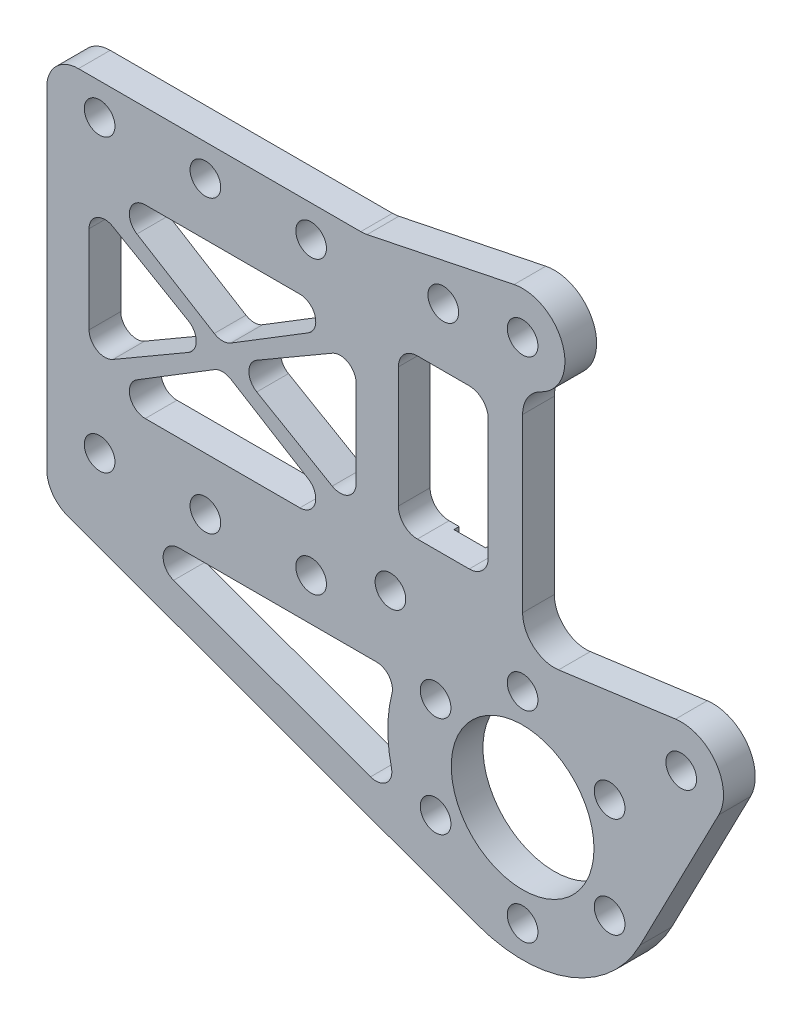
from build123d import *

# Parameters (mm, degrees)
SKETCH_2_R          = 6.75
SKETCH_2_R_2        = 1.45
EXTRUDE_1_DEPTH     = 3
EXTRUDE_START       = -3
SKETCH_4_R          = 1.45
EXTRUDE_2_DEPTH     = 3
SKETCH_5_R          = 1.45
SKETCH_5_W          = 8.5
SKETCH_5_H          = 15
EXTRUDE_3_DEPTH     = 3
SKETCH_7_R          = 1.45
CUT_EXTRUDE_3_DEPTH = 20
FILLET_1_R          = 1.8
FILLET_2_R          = 3
SKETCH_9_R          = 1.45
CUT_EXTRUDE_5_DEPTH = 10.5
FILLET_3_R          = 1.5
SKETCH_10_W         = 3
SKETCH_10_H         = 20
CUT_EXTRUDE_6_DEPTH = 0.5
SKETCH_11_R         = 0.9
CUT_EXTRUDE_7_DEPTH = 0.5


with BuildPart() as part:
    # 草图2 → 凸台-拉伸1 (new body)
    with BuildSketch(Plane.XY):
        with BuildLine():
            Line((-10, -7), (-10, -16.423561614))
            Line((-10, -16.423561614), (30.724748208, -31.24615776))
            ThreePointArc((30.724748208, -31.24615776), (47.310096913, -21.670602221), (35, -7))
            Line((35, -7), (-10, -7))
        make_face()
        with Locations((35, -19.5)):
            Circle(SKETCH_2_R, mode=Mode.SUBTRACT)
        with Locations((15, -10.5)):
            Circle(SKETCH_2_R_2, mode=Mode.SUBTRACT)
        with Locations((5, -10.5)):
            Circle(SKETCH_2_R_2, mode=Mode.SUBTRACT)
        with Locations((-5, -10.5)):
            Circle(SKETCH_2_R_2, mode=Mode.SUBTRACT)
    extrude(amount=EXTRUDE_1_DEPTH)

    # 草图4 → 凸台-拉伸2 (add)
    with BuildSketch(Plane.XY.offset(3).offset(EXTRUDE_START)):
        with BuildLine():
            Line((35, -7), (49.461817276, -5.036370432))
            ThreePointArc((49.461817276, -5.036370432), (53.268884157, -6.694702543), (53.552947171, -10.837543578))
            Line((53.552947171, -10.837543578), (46.102959909, -25.24232368))
            ThreePointArc((46.102959909, -25.24232368), (45.677758332, -13.00111725), (35, -7))
        make_face()
        with Locations((50, -9)):
            Circle(SKETCH_4_R, mode=Mode.SUBTRACT)
    extrude(amount=EXTRUDE_2_DEPTH)

    # 草图5 → 凸台-拉伸3 (add)
    with BuildSketch(Plane(origin=(0, 0, 0), x_dir=(-1, 0, 0), z_dir=(0, 0, -1))):
        with BuildLine():
            Line((-35, -7), (-35, 15))
            ThreePointArc((-35, 15), (-38.979463437, 19.404809528), (-34.194537642, 22.918064623))
            Line((-34.194537642, 22.918064623), (-20, 20))
            Line((-20, 20), (10, 20))
            Line((10, 20), (10, -7))
            Line((10, -7), (-35, -7))
        make_face()
        with Locations((-35, 19)):
            Circle(SKETCH_5_R, mode=Mode.SUBTRACT)
        with Locations((-27.5, 5)):
            Rectangle(SKETCH_5_W, SKETCH_5_H, mode=Mode.SUBTRACT)
    extrude(amount=-EXTRUDE_3_DEPTH)

    # 草图7 → 切除-拉伸3 (cut)
    with BuildSketch(Plane.XY.offset(3)):
        with Locations((27.5, 18)):
            Circle(SKETCH_7_R)
        with Locations((-5, 17)):
            Circle(SKETCH_7_R)
        with Locations((5, 17)):
            Circle(SKETCH_7_R)
        with Locations((15, 17)):
            Circle(SKETCH_7_R)
        with Locations((22.5, -8)):
            Circle(SKETCH_7_R)
    extrude(amount=-CUT_EXTRUDE_3_DEPTH, mode=Mode.SUBTRACT)

    # 圆角1
    fillet_1_edges = [part.edges().sort_by_distance(p)[0] for p in [
        (31.75, 12.5, 1.5),
        (23.25, 12.5, 1.5),
        (23.25, -2.5, 1.5),
        (31.75, -2.5, 1.5),
    ]]
    fillet(fillet_1_edges, radius=FILLET_1_R)

    # 圆角2
    fillet_2_edges = [part.edges().sort_by_distance(p)[0] for p in [
        (35, 15, 1.5),
        (20, 20, 1.5),
        (-10, 20, 1.5),
        (35, -7, 1.5),
        (-10, -16.423561614, 1.5),
    ]]
    fillet(fillet_2_edges, radius=FILLET_2_R)

    # 草图9 → 切除-拉伸5 (cut)
    with BuildSketch(Plane(origin=(0, 0, 0), x_dir=(-1, 0, 0), z_dir=(0, 0, -1))):
        with Locations((-26.772758664, -14.75)):
            Circle(SKETCH_9_R)
        with Locations((-26.772758664, -24.25)):
            Circle(SKETCH_9_R)
        with Locations((-35, -29)):
            Circle(SKETCH_9_R)
        with Locations((-43.227241336, -24.25)):
            Circle(SKETCH_9_R)
        with Locations((-43.227241336, -14.75)):
            Circle(SKETCH_9_R)
        with Locations((-35, -10)):
            Circle(SKETCH_9_R)
        Polygon((-6.625, 4.25), (-19.25, 12), (6, 12), align=None)
        Polygon((-7.625, 3.25), (-19.25, 10), (-19.25, -3.5), align=None)
        Polygon((6, 10), (6, -3.5), (-5.625, 3.25), align=None)
        Polygon((-19.25, -5.5), (6, -5.5), (-6.625, 2.25), align=None)
        with BuildLine():
            Line((-23.271295894, -14.5), (6, -14.5))
            Line((6, -14.5), (-23.639402612, -25.287860312))
            ThreePointArc((-23.639402612, -25.287860312), (-22.257416141, -19.934806402), (-23.271295894, -14.5))
        make_face()
    extrude(amount=-CUT_EXTRUDE_5_DEPTH, mode=Mode.SUBTRACT)

    # 圆角3
    fillet_3_edges = [part.edges().sort_by_distance(p)[0] for p in [
        (5.625, 3.25, 1.5),
        (-6, 10, 1.5),
        (-6, -3.5, 1.5),
        (19.25, -5.5, 1.5),
        (6.625, 2.25, 1.5),
        (-6, -5.5, 1.5),
        (23.639402612, -25.287860312, 1.5),
        (23.271295894, -14.5, 1.5),
        (-6, -14.5, 1.5),
        (7.625, 3.25, 1.5),
        (19.25, -3.5, 1.5),
        (19.25, 10, 1.5),
        (-6, 12, 1.5),
        (6.625, 4.25, 1.5),
        (19.25, 12, 1.5),
    ]]
    fillet(fillet_3_edges, radius=FILLET_3_R)

    # 草图10 → 切除-拉伸6 (cut)
    with BuildSketch(Plane(origin=(0, 0, 0), x_dir=(-1, 0, 0), z_dir=(0, 0, -1))):
        with Locations((-27.5, 5)):
            Rectangle(SKETCH_10_W, SKETCH_10_H)
    extrude(amount=-CUT_EXTRUDE_6_DEPTH, mode=Mode.SUBTRACT)

    # 草图11 → 切除-拉伸7 (cut)
    with BuildSketch(Plane(origin=(0, 0, 0), x_dir=(-1, 0, 0), z_dir=(0, 0, -1))):
        with Locations((-29, 14.1)):
            Circle(SKETCH_11_R)
        with Locations((-26, 14.1)):
            Circle(SKETCH_11_R)
        with Locations((-29, -4.1)):
            Circle(SKETCH_11_R)
        with Locations((-26, -4.1)):
            Circle(SKETCH_11_R)
    extrude(amount=-CUT_EXTRUDE_7_DEPTH, mode=Mode.SUBTRACT)


solid = part.part
